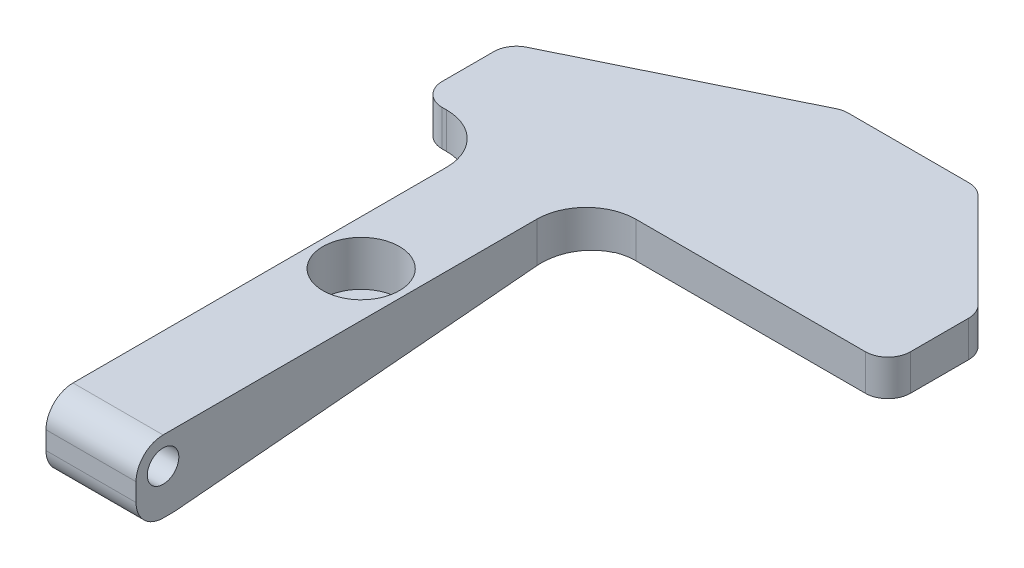
from build123d import *

# Parameters (mm, degrees)
SKETCH1_R           = 1.75
BOSS_EXTRUDE1_DEPTH = 8.5
FILLET1_R           = 3
SKETCH3_R           = 4.25
CUT_EXTRUDE3_DEPTH  = 5
CUT_EXTRUDE4_REACH  = 50.428
BOSS_EXTRUDE2_DEPTH = 4
CUT_EXTRUDE5_REACH  = 81.418


with BuildPart() as part:
    # Sketch1 → Boss-Extrude1 (new, symmetric)
    with BuildSketch(Plane(origin=(0, 0, 0), x_dir=(0, 0, -1), z_dir=(1, 0, 0))):
        with BuildLine():
            ThreePointArc((0, 3), (-2.121320344, 2.121320344), (-3, 0))
            Line((-3, 0), (-3, -5))
            Line((-3, -5), (1.279790789, -5))
            Line((1.279790789, -5), (47, -1))
            Line((47, -1), (47, 3))
            Line((47, 3), (0, 3))
        make_face()
        Circle(SKETCH1_R, mode=Mode.SUBTRACT)
    extrude(amount=BOSS_EXTRUDE1_DEPTH, both=True)

    # Fillet1
    fillet1_edges = [part.edges().sort_by_distance(p)[0] for p in [
        (0, -5, 3),
    ]]
    fillet(fillet1_edges, radius=FILLET1_R)

    # Sketch3 → Cut-Extrude3 (cut)
    with BuildSketch(Plane(origin=(0, 3, 0), x_dir=(1, 0, 0), z_dir=(0, 1, 0))):
        with Locations(Location((0, 27, 0), (0, 0, 270))):
            Circle(SKETCH3_R)
    extrude(amount=-CUT_EXTRUDE3_DEPTH, mode=Mode.SUBTRACT)

    # Sketch4 → Cut-Extrude4 (cut, up to next)
    with BuildSketch(Plane(origin=(0, 3, 0), x_dir=(1, 0, 0), z_dir=(0, 1, 0)), mode=Mode.PRIVATE) as cut_extrude4_sk1:
        with BuildLine():
            Line((-8.5, -3), (-5, -3))
            Line((-5, -3), (-5, 32.6))
            ThreePointArc((-5, 32.6), (-5.995836944, 35.004163056), (-8.4, 36))
            Line((-8.4, 36), (-8.5, 36))
            Line((-8.5, 36), (-8.5, -3))
        make_face()
    cut_extrude4_tool1 = extrude(cut_extrude4_sk1.sketch, amount=-CUT_EXTRUDE4_REACH, mode=Mode.PRIVATE) & part.part
    # Sketch4 → Cut-Extrude4 (cut, up to next)
    with BuildSketch(Plane(origin=(0, 3, 0), x_dir=(1, 0, 0), z_dir=(0, 1, 0)), mode=Mode.PRIVATE) as cut_extrude4_sk2:
        with BuildLine():
            Line((8.4, 36), (8.5, 36))
            Line((8.5, 36), (8.5, -3))
            Line((8.5, -3), (5, -3))
            Line((5, -3), (5, 32.6))
            ThreePointArc((5, 32.6), (5.995836944, 35.004163056), (8.4, 36))
        make_face()
    cut_extrude4_tool2 = extrude(cut_extrude4_sk2.sketch, amount=-CUT_EXTRUDE4_REACH, mode=Mode.PRIVATE) & part.part
    add(cut_extrude4_tool1.solids().sort_by_distance((-6.768336, 3, -16.153098))[0], mode=Mode.SUBTRACT)
    add(cut_extrude4_tool2.solids().sort_by_distance((6.768336, 3, -16.153098))[0], mode=Mode.SUBTRACT)

    # Sketch5 → Boss-Extrude2 (add)
    with BuildSketch(Plane(origin=(0, 3, 0), x_dir=(1, 0, 0), z_dir=(0, 1, 0))):
        with BuildLine():
            ThreePointArc((-11, 47), (-12.767766953, 47.732233047), (-13.5, 49.5))
            Line((-13.5, 49.5), (-13.5, 55.23782662))
            ThreePointArc((-13.5, 55.23782662), (-13.12012024, 56.562624781), (-12.095927867, 57.484811736))
            Line((-12.095927867, 57.484811736), (10.994949478, 68.746985116))
            ThreePointArc((10.994949478, 68.746985116), (11.528499709, 68.935925162), (12.090877345, 69))
            Line((12.090877345, 69), (25.464466094, 69))
            ThreePointArc((25.464466094, 69), (26.421174675, 68.809698831), (27.232233047, 68.267766953))
            Line((27.232233047, 68.267766953), (37.767766953, 57.732233047))
            ThreePointArc((37.767766953, 57.732233047), (38.309698831, 56.921174675), (38.5, 55.964466094))
            Line((38.5, 55.964466094), (38.5, 49.5))
            ThreePointArc((38.5, 49.5), (37.767766953, 47.732233047), (36, 47))
            Line((36, 47), (8.5, 47))
            Line((8.5, 47), (-8.5, 47))
            Line((-8.5, 47), (-11, 47))
        make_face()
        with BuildLine():
            Line((10.5, 47), (8.5, 47))
            Line((8.5, 47), (8.5, 45))
            ThreePointArc((8.5, 45), (9.085786438, 46.414213562), (10.5, 47))
        make_face()
        with BuildLine():
            Line((-8.5, 45), (-8.5, 47))
            Line((-8.5, 47), (-10.5, 47))
            ThreePointArc((-10.5, 47), (-9.085786438, 46.414213562), (-8.5, 45))
        make_face()
    extrude(amount=-BOSS_EXTRUDE2_DEPTH)

    # Sketch6 → Cut-Extrude5 (cut, up to next)
    with BuildSketch(Plane(origin=(0, 3, 0), x_dir=(1, 0, 0), z_dir=(0, 1, 0)), mode=Mode.PRIVATE) as cut_extrude5_sk1:
        with BuildLine():
            Line((5, 32.6), (5, 41.5))
            ThreePointArc((5, 41.5), (6.610912703, 45.389087297), (10.5, 47))
            Line((10.5, 47), (10.5, 32.6))
            Line((10.5, 32.6), (5, 32.6))
        make_face()
    cut_extrude5_tool1 = extrude(cut_extrude5_sk1.sketch, amount=-CUT_EXTRUDE5_REACH, mode=Mode.PRIVATE) & part.part
    # Sketch6 → Cut-Extrude5 (cut, up to next)
    with BuildSketch(Plane(origin=(0, 3, 0), x_dir=(1, 0, 0), z_dir=(0, 1, 0)), mode=Mode.PRIVATE) as cut_extrude5_sk2:
        with BuildLine():
            Line((-5, 32.6), (-10.5, 32.6))
            Line((-10.5, 32.6), (-10.5, 47))
            ThreePointArc((-10.5, 47), (-6.610912703, 45.389087297), (-5, 41.5))
            Line((-5, 41.5), (-5, 32.6))
        make_face()
    cut_extrude5_tool2 = extrude(cut_extrude5_sk2.sketch, amount=-CUT_EXTRUDE5_REACH, mode=Mode.PRIVATE) & part.part
    add(cut_extrude5_tool1.solids().sort_by_distance((7.885844, 3, -39.266841))[0], mode=Mode.SUBTRACT)
    add(cut_extrude5_tool2.solids().sort_by_distance((-7.885844, 3, -39.266841))[0], mode=Mode.SUBTRACT)


solid = part.part
